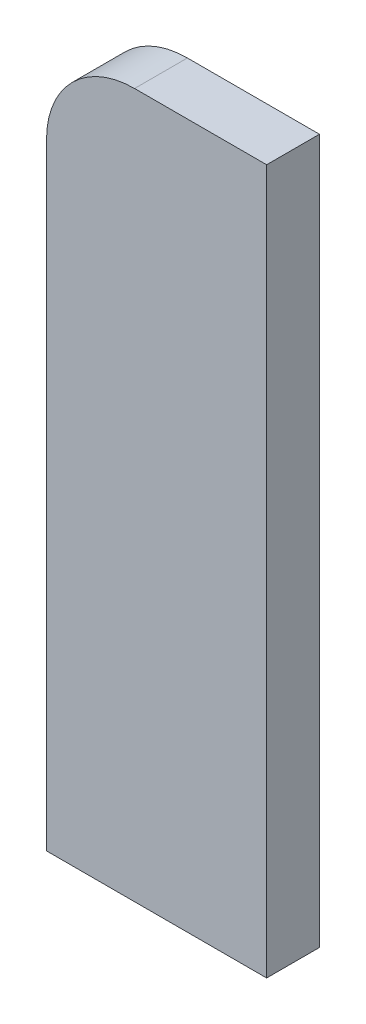
from build123d import *

# Parameters (mm, degrees)
ESQUISSE1_W      = 25
ESQUISSE1_H      = 80
EXTRUSION1_DEPTH = 6
CONG_1_R         = 10


with BuildPart() as part:
    # Esquisse1 → Extrusion1 (new body)
    with BuildSketch(Plane.XY):
        with Locations((-17.5, 10)):
            Rectangle(ESQUISSE1_W, ESQUISSE1_H)
    extrude(amount=EXTRUSION1_DEPTH)

    # Congé1
    cong_1_edges = [part.edges().sort_by_distance(p)[0] for p in [
        (-30, 50, 3),
    ]]
    fillet(cong_1_edges, radius=CONG_1_R)


solid = part.part
